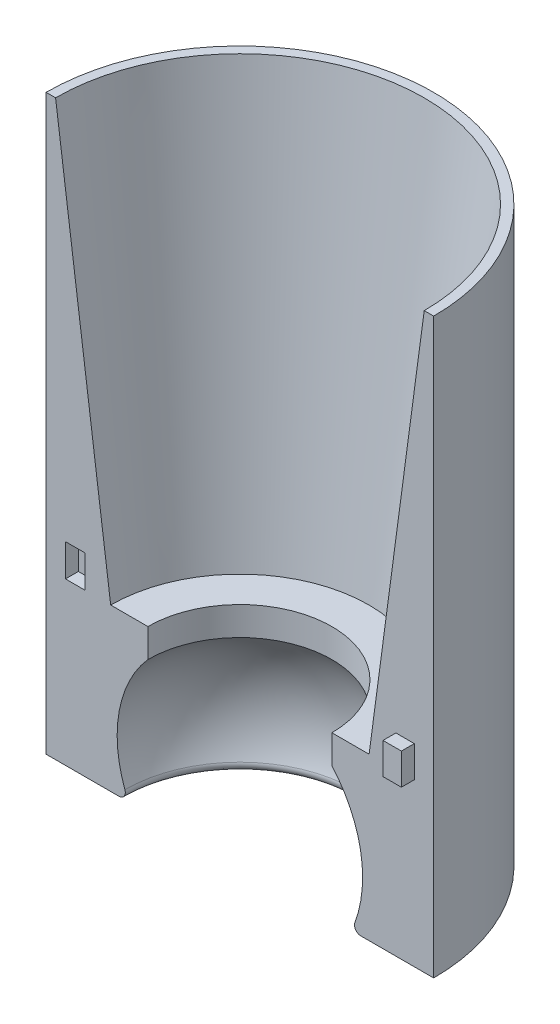
from build123d import *

# Parameters (mm, degrees)
REVOLVE8_ANGLE      = 180
SKETCH5_W           = 2.85
SKETCH5_H           = 4.85
BOSS_EXTRUDE1_DEPTH = 2
SKETCH6_W           = 3
SKETCH6_H           = 5
CUT_EXTRUDE1_DEPTH  = 2
FILLET1_R           = 1


with BuildPart() as part:
    # Sketch3 → Revolve8 (revolve)
    with BuildSketch(Plane.XY):
        with BuildLine():
            Line((-29.128306284, 11.200453936), (-37.660231074, 74.93674596))
            Line((-37.660231074, 74.93674596), (-39.127877823, 74.93674596))
            Line((-39.127877823, 74.93674596), (-39.127877823, -13.799546064))
            Line((-39.127877823, -13.799546064), (-26.361565762, -13.799546064))
            ThreePointArc((-26.361565762, -13.799546064), (-27.930281109, -3.066483557), (-23.370793287, 6.77580121))
            Line((-23.370793287, 6.77580121), (-23.370793287, 11.200453936))
            Line((-23.370793287, 11.200453936), (-29.128306284, 11.200453936))
        make_face()
    revolve(axis=Axis((-9.127877823, 95.858464184, 0), (0, -1, 0)), revolution_arc=REVOLVE8_ANGLE)

    # Sketch5 → Boss-Extrude1 (add)
    with BuildSketch(Plane.XY):
        with Locations((16.447122177, 13.700453936)):
            Rectangle(SKETCH5_W, SKETCH5_H)
    extrude(amount=BOSS_EXTRUDE1_DEPTH)

    # Sketch6 → Cut-Extrude1 (cut)
    with BuildSketch(Plane.XY):
        with Locations((-34.627877823, 13.700453936)):
            Rectangle(SKETCH6_W, SKETCH6_H)
    extrude(amount=-CUT_EXTRUDE1_DEPTH, mode=Mode.SUBTRACT)

    # Fillet1
    fillet1_edges = [part.edges().sort_by_distance(p)[0] for p in [
        (-9.127877823, -13.799546064, -17.23368794),
    ]]
    fillet(fillet1_edges, radius=FILLET1_R)


solid = part.part
